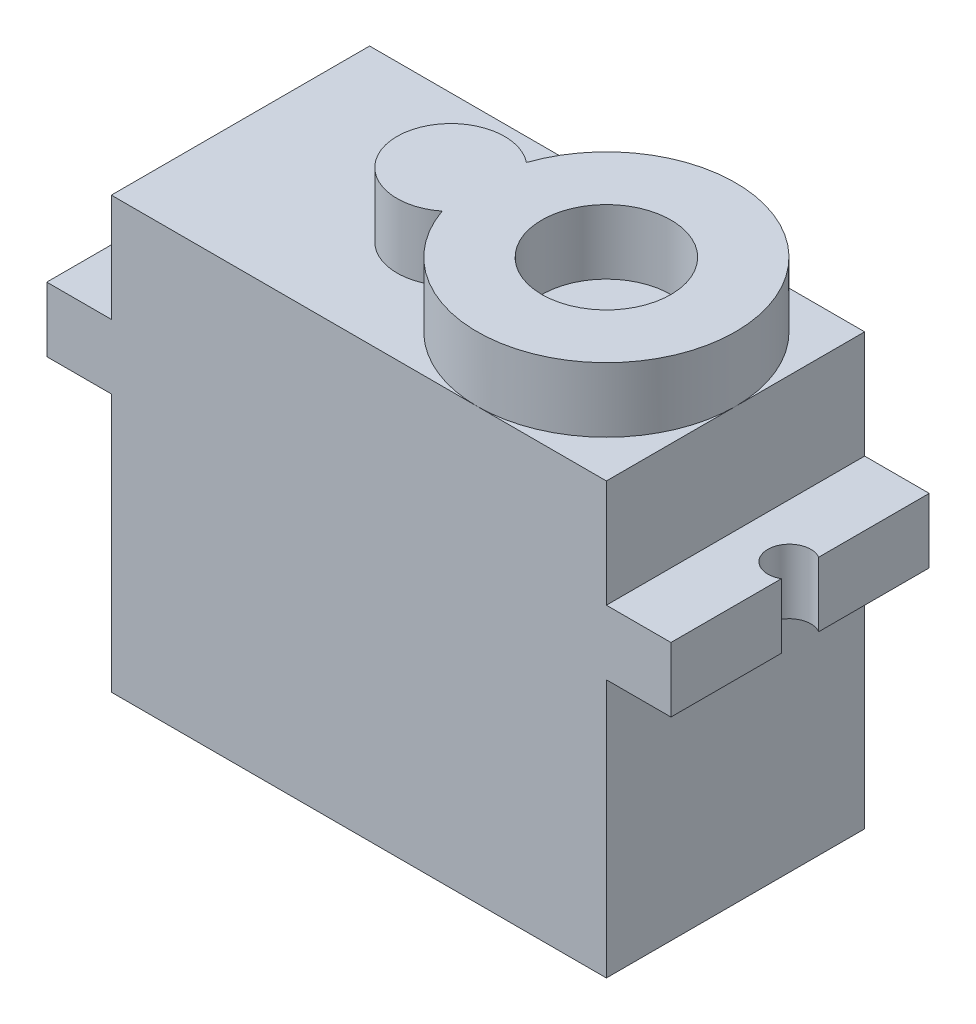
from build123d import *

# Parameters (mm, degrees)
BOSS_EXTRUDE1_DEPTH = 6
SKETCH2_R           = 1
CUT_EXTRUDE1_DEPTH  = 22.708293346
SKETCH3_R           = 1.25
SKETCH3_R_2         = 1
CUT_EXTRUDE2_DEPTH  = 0.5
SKETCH3_2_R         = 1
CUT_EXTRUDE3_DEPTH  = 12
SKETCH4_R           = 3
BOSS_EXTRUDE2_DEPTH = 3


with BuildPart() as part:
    # Sketch1 → Boss-Extrude1 (new, symmetric)
    with BuildSketch(Plane.XY):
        Polygon((-14.5, 0), (-11.5, 0), (-11.5, -12), (11.5, -12), (11.5, 0), (14.5, 0), (14.5, 3), (11.5, 3), (11.5, 8), (-11.5, 8), (-11.5, 3), (-14.5, 3), align=None)
    extrude(amount=BOSS_EXTRUDE1_DEPTH, both=True)

    # Sketch2 → Cut-Extrude1 (cut, through all)
    with BuildSketch(Plane(origin=(0, 3, 0), x_dir=(1, 0, 0), z_dir=(0, 1, 0))):
        with Locations((14, 0)):
            Circle(SKETCH2_R)
        with Locations((-14, 0)):
            Circle(SKETCH2_R)
    extrude(amount=-CUT_EXTRUDE1_DEPTH, mode=Mode.SUBTRACT)

    # Sketch3 → Cut-Extrude2 (cut)
    # profile 1 of 4: a face of its own
    with BuildSketch(Plane.XZ.offset(12)):
        with Locations((9.5, -4)):
            Circle(SKETCH3_R)
        with Locations((9.5, -4)):
            Circle(SKETCH3_R_2, mode=Mode.SUBTRACT)
    # profile 2 of 4: a face of its own
    with BuildSketch(Plane.XZ.offset(12)):
        with Locations((9.5, 4)):
            Circle(SKETCH3_R)
        with Locations((9.5, 4)):
            Circle(SKETCH3_R_2, mode=Mode.SUBTRACT)
    # profile 3 of 4: a face of its own
    with BuildSketch(Plane.XZ.offset(12)):
        with Locations((-9.5, -4)):
            Circle(SKETCH3_R)
        with Locations((-9.5, -4)):
            Circle(SKETCH3_R_2, mode=Mode.SUBTRACT)
    # profile 4 of 4: a face of its own
    with BuildSketch(Plane.XZ.offset(12)):
        with Locations((-9.5, 4)):
            Circle(SKETCH3_R)
        with Locations((-9.5, 4)):
            Circle(SKETCH3_R_2, mode=Mode.SUBTRACT)
    extrude(amount=-CUT_EXTRUDE2_DEPTH, mode=Mode.SUBTRACT)

    # Sketch3<2> → Cut-Extrude3 (cut)
    with BuildSketch(Plane.XZ.offset(12)):
        with Locations((9.5, -4)):
            Circle(SKETCH3_2_R)
        with Locations((9.5, 4)):
            Circle(SKETCH3_2_R)
        with Locations((-9.5, -4)):
            Circle(SKETCH3_2_R)
        with Locations((-9.5, 4)):
            Circle(SKETCH3_2_R)
    extrude(amount=-CUT_EXTRUDE3_DEPTH, mode=Mode.SUBTRACT)

    # Sketch4 → Boss-Extrude2 (add)
    with BuildSketch(Plane(origin=(0, 8, 0), x_dir=(1, 0, 0), z_dir=(0, 1, 0))):
        with BuildLine():
            ThreePointArc((-0.171650012, -1.957648115), (11.5, 0), (-0.171650012, 1.957648115))
            ThreePointArc((-0.171650012, 1.957648115), (-4.226517806, 0), (-0.171650012, -1.957648115))
        make_face()
        with Locations((5.5, 0)):
            Circle(SKETCH4_R, mode=Mode.SUBTRACT)
    extrude(amount=BOSS_EXTRUDE2_DEPTH)


solid = part.part
